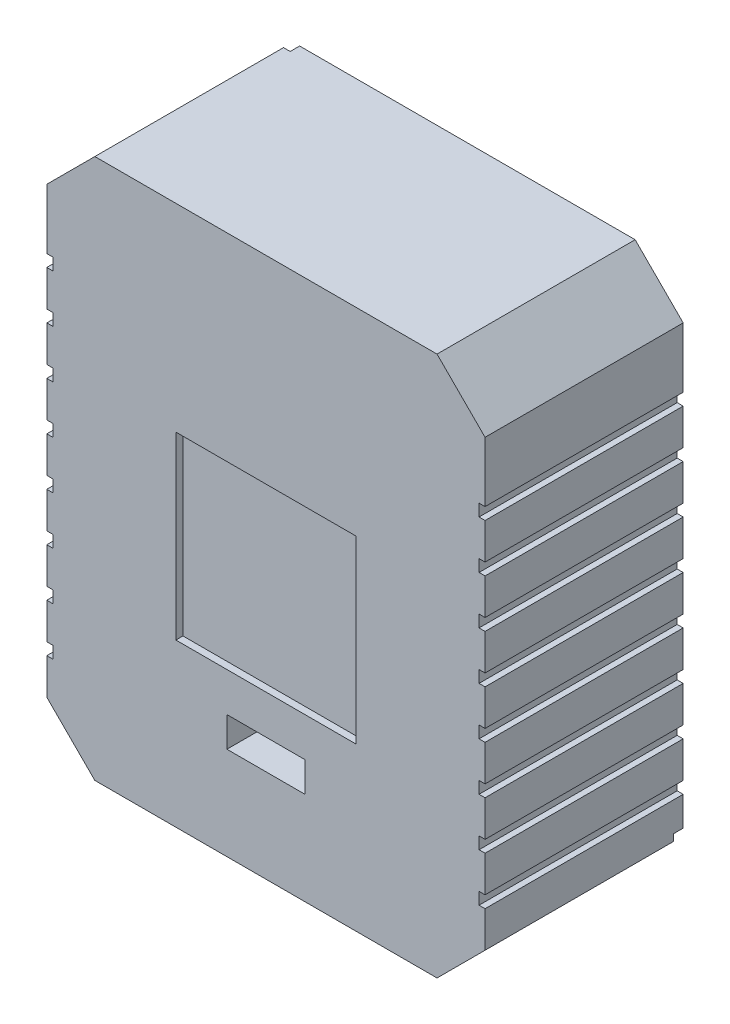
from build123d import *

# Parameters (mm, degrees)
SKETCH1_W           = 92.71
SKETCH1_H           = 114.3
BOSS_EXTRUDE1_DEPTH = 41.91
SKETCH2_W           = 2.54
SKETCH2_H           = 2.54
CUT_EXTRUDE1_DEPTH  = 85.683862837
CHAMFER1_SIZE       = 10.16
SKETCH3_R           = 1.750000056
CUT_EXTRUDE2_DEPTH  = 25.4
SKETCH4_W           = 78.71
SKETCH4_H           = 100.30000006
CUT_EXTRUDE3_DEPTH  = 35.56
SKETCH6_W           = 16.51
SKETCH6_H           = 6.35
CUT_EXTRUDE5_DEPTH  = 85.683862837
CUT_EXTRUDE6_DEPTH  = 2
SKETCH8_W           = 38.1
SKETCH8_H           = 38.1
CUT_EXTRUDE7_DEPTH  = 1.5


with BuildPart() as part:
    # Sketch1 → Boss-Extrude1 (new body)
    with BuildSketch(Plane.XY):
        Rectangle(SKETCH1_W, SKETCH1_H)
    extrude(amount=BOSS_EXTRUDE1_DEPTH)

    # Sketch2 → Cut-Extrude1 (cut, through all)
    with BuildSketch(Plane(origin=(0, 0, 0), x_dir=(-1, 0, 0), z_dir=(0, 0, -1))):
        with Locations((-46.355, -38.1)):
            Rectangle(SKETCH2_W, SKETCH2_H)
        with Locations((46.355, -38.1)):
            Rectangle(SKETCH2_W, SKETCH2_H)
        with Locations((-46.355, -27.94)):
            Rectangle(SKETCH2_W, SKETCH2_H)
        with Locations((46.355, -27.94)):
            Rectangle(SKETCH2_W, SKETCH2_H)
        with Locations((-46.355, -17.78)):
            Rectangle(SKETCH2_W, SKETCH2_H)
        with Locations((46.355, -17.78)):
            Rectangle(SKETCH2_W, SKETCH2_H)
        with Locations((-46.355, -7.62)):
            Rectangle(SKETCH2_W, SKETCH2_H)
        with Locations((46.355, -7.62)):
            Rectangle(SKETCH2_W, SKETCH2_H)
        with Locations((-46.355, 2.54)):
            Rectangle(SKETCH2_W, SKETCH2_H)
        with Locations((46.355, 2.54)):
            Rectangle(SKETCH2_W, SKETCH2_H)
        with Locations((-46.355, 12.7)):
            Rectangle(SKETCH2_W, SKETCH2_H)
        with Locations((46.355, 12.7)):
            Rectangle(SKETCH2_W, SKETCH2_H)
        with Locations((-46.355, 22.86)):
            Rectangle(SKETCH2_W, SKETCH2_H)
        with Locations((46.355, 22.86)):
            Rectangle(SKETCH2_W, SKETCH2_H)
        with Locations((-46.355, 33.02)):
            Rectangle(SKETCH2_W, SKETCH2_H)
        with Locations((46.355, 33.02)):
            Rectangle(SKETCH2_W, SKETCH2_H)
    extrude(amount=-CUT_EXTRUDE1_DEPTH, mode=Mode.SUBTRACT)

    # Chamfer1
    chamfer1_edges = [part.edges().sort_by_distance(p)[0] for p in [
        (46.355, -57.15, 20.955),
        (-46.355, -57.15, 20.955),
        (-46.355, 57.15, 20.955),
        (46.355, 57.15, 20.955),
    ]]
    chamfer(chamfer1_edges, length=CHAMFER1_SIZE)

    # Sketch3 → Cut-Extrude2 (cut)
    with BuildSketch(Plane(origin=(0, 0, 0), x_dir=(-1, 0, 0), z_dir=(0, 0, -1))):
        with Locations((-27.305, -53.649999888)):
            Circle(SKETCH3_R)
        with Locations((-27.305, 53.65)):
            Circle(SKETCH3_R)
        with Locations((27.305, 53.649999888)):
            Circle(SKETCH3_R)
        with Locations((27.305, -53.649999888)):
            Circle(SKETCH3_R)
    extrude(amount=-CUT_EXTRUDE2_DEPTH, mode=Mode.SUBTRACT)

    # Sketch4 → Cut-Extrude3 (cut)
    with BuildSketch(Plane(origin=(0, 0, 0), x_dir=(-1, 0, 0), z_dir=(0, 0, -1))):
        Rectangle(SKETCH4_W, SKETCH4_H)
    extrude(amount=-CUT_EXTRUDE3_DEPTH, mode=Mode.SUBTRACT)

    # Sketch6 → Cut-Extrude5 (cut, through all)
    with BuildSketch(Plane.XY.offset(41.91)):
        with Locations((0, -34.29)):
            Rectangle(SKETCH6_W, SKETCH6_H)
    extrude(amount=-CUT_EXTRUDE5_DEPTH, mode=Mode.SUBTRACT)

    # Sketch7 → Cut-Extrude6 (cut)
    with BuildSketch(Plane(origin=(0, 0, 0), x_dir=(-1, 0, 0), z_dir=(0, 0, -1))):
        Polygon((40.567893219, 51.362893219), (46.355, 45.575786438), (46.355, 46.99), (36.195, 57.15), (34.780786438, 57.15), align=None)
        Polygon((-40.567893219, -51.362893219), (-46.355, -45.575786438), (-46.355, -46.99), (-36.195, -57.15), (-34.780786438, -57.15), align=None)
    extrude(amount=-CUT_EXTRUDE6_DEPTH, mode=Mode.SUBTRACT)

    # Sketch8 → Cut-Extrude7 (cut)
    with BuildSketch(Plane.XY.offset(41.91)):
        with Locations((0, -3.81)):
            Rectangle(SKETCH8_W, SKETCH8_H)
    extrude(amount=-CUT_EXTRUDE7_DEPTH, mode=Mode.SUBTRACT)


solid = part.part
